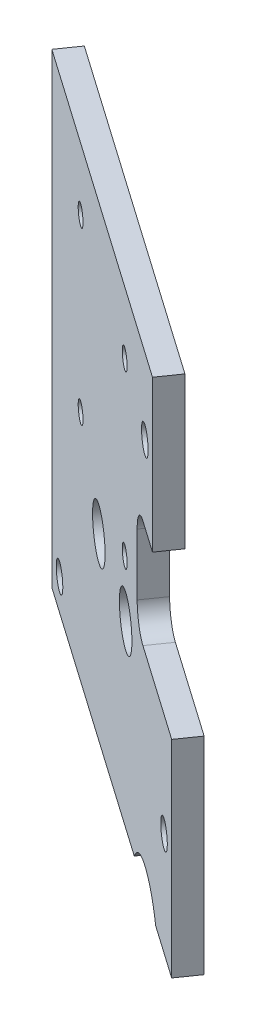
from build123d import *

# Parameters (mm, degrees)
SKETCH1_R                                            = 3.25
BOSS_EXTRUDE1_DEPTH                                  = 3
SKETCH7_R                                            = 1.25
CUT_EXTRUDE1_DEPTH                                   = 3
CSK_FOR_M3_HEX_SOCKET_COUNTERSUNK_HEAD_S_D           = 3.4
CSK_FOR_M3_HEX_SOCKET_COUNTERSUNK_HEAD_S_DEPTH       = 3
CSK_FOR_M3_HEX_SOCKET_COUNTERSUNK_HEAD_S_CSINK_D     = 6.94
CSK_FOR_M3_HEX_SOCKET_COUNTERSUNK_HEAD_S_CSINK_ANGLE = 90
CSK_FOR_M3_HEX_SOCKET_COUNTERSUNK_HEAD_S_TIP         = 1.021463052


with BuildPart() as part:
    # Sketch1 → Boss-Extrude1 (new body)
    with BuildSketch(Plane(origin=(14.780047825, 0, -21.146325355), x_dir=(-0.8196392423560167, 0, -0.5728800157014161), z_dir=(0.5728800157014161, 0, -0.8196392423560169))):
        with BuildLine():
            Line((13.893407272, 266.511550752), (18.893407272, 266.511550752))
            ThreePointArc((18.893407272, 266.511550752), (21.014727616, 265.632871095), (21.893407272, 263.511550752))
            Line((21.893407272, 263.511550752), (21.893407272, 255.611550752))
            ThreePointArc((21.893407272, 255.611550752), (21.014727616, 253.490230408), (18.893407272, 252.611550752))
            Line((18.893407272, 252.611550752), (3.879256414, 252.611550752))
            Line((3.879256414, 252.611550752), (3.879256414, 226.011550752))
            Line((3.879256414, 226.011550752), (12.21108842, 226.011550752))
            ThreePointArc((12.21108842, 226.011550752), (17.804454002, 228.802722193), (23.397819584, 226.011550752))
            Line((23.397819584, 226.011550752), (66.393407272, 226.011550752))
            Line((66.393407272, 226.011550752), (66.393407272, 286.011550752))
            Line((66.393407272, 286.011550752), (13.893407272, 286.011550752))
            Line((13.893407272, 286.011550752), (13.893407272, 266.511550752))
        make_face()
        with Locations((27.893407272, 249.061550752)):
            Circle(SKETCH1_R, mode=Mode.SUBTRACT)
        with Locations((41.893407272, 249.061550752)):
            Circle(SKETCH1_R, mode=Mode.SUBTRACT)
    extrude(amount=BOSS_EXTRUDE1_DEPTH)

    # Sketch7 → Cut-Extrude1 (cut)
    with BuildSketch(Plane(origin=(16.498687872, 0, -23.605243082), x_dir=(-0.8196392423560169, 0, -0.572880015701416), z_dir=(0.572880015701416, 0, -0.8196392423560169))):
        with Locations((28.393407272, 278.011550752)):
            Circle(SKETCH7_R)
        with Locations((51.393407272, 278.011550752)):
            Circle(SKETCH7_R)
        with Locations((28.393407272, 256.011550752)):
            Circle(SKETCH7_R)
        with Locations((51.393407272, 256.011550752)):
            Circle(SKETCH7_R)
    extrude(amount=-CUT_EXTRUDE1_DEPTH, mode=Mode.SUBTRACT)

    # CSK for M3 Hex Socket Countersunk Head Screw2
    with Locations(Plane(origin=(16.498687872, 0, -23.605243082), x_dir=(-0.8196392423560169, 0, -0.572880015701416), z_dir=(0.572880015701416, 0, -0.819639242356017))):
        with Locations((17.893407272, 276.261550752), (7.879256414, 239.311550752), (62.393407272, 230.011550752)):
            CounterSinkHole(CSK_FOR_M3_HEX_SOCKET_COUNTERSUNK_HEAD_S_D / 2, CSK_FOR_M3_HEX_SOCKET_COUNTERSUNK_HEAD_S_CSINK_D / 2, depth=CSK_FOR_M3_HEX_SOCKET_COUNTERSUNK_HEAD_S_DEPTH, counter_sink_angle=CSK_FOR_M3_HEX_SOCKET_COUNTERSUNK_HEAD_S_CSINK_ANGLE)
            with Locations((0, 0, -(CSK_FOR_M3_HEX_SOCKET_COUNTERSUNK_HEAD_S_DEPTH + CSK_FOR_M3_HEX_SOCKET_COUNTERSUNK_HEAD_S_TIP / 2))):  # 118° drill point
                Cone(0, CSK_FOR_M3_HEX_SOCKET_COUNTERSUNK_HEAD_S_D / 2, CSK_FOR_M3_HEX_SOCKET_COUNTERSUNK_HEAD_S_TIP, mode=Mode.SUBTRACT)


solid = part.part
